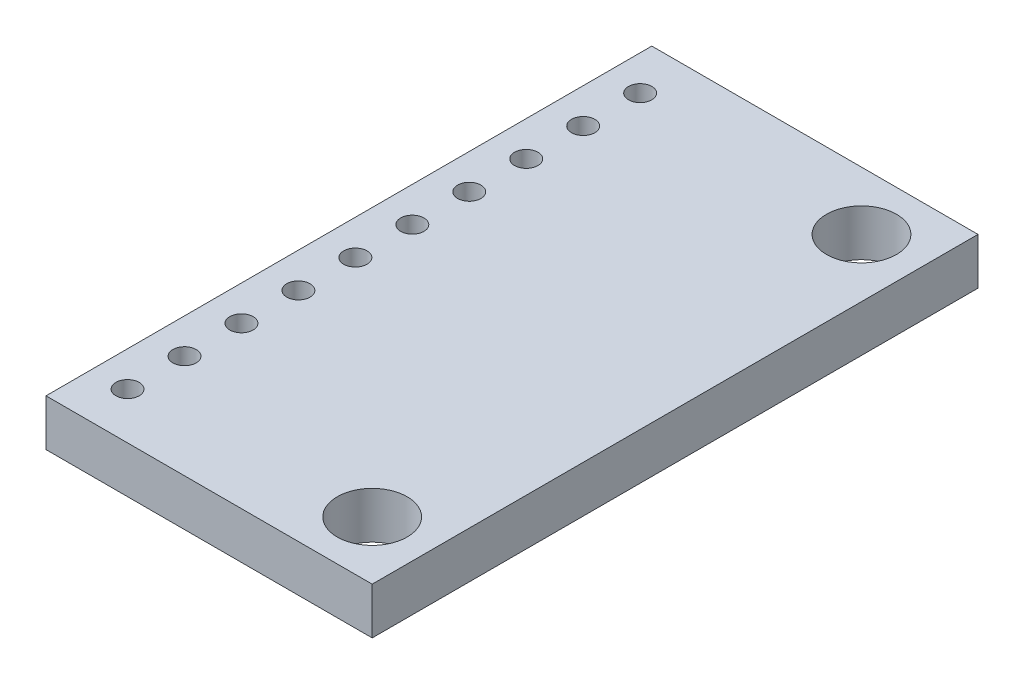
from build123d import *

# Parameters (mm, degrees)
SKETCH1_W           = 14
SKETCH1_H           = 26
BOSS_EXTRUDE1_DEPTH = 2
SKETCH2_R           = 1.5
CUT_EXTRUDE1_DEPTH  = 15.899664426
SKETCH3_R           = 0.5
CUT_EXTRUDE2_DEPTH  = 15.899664426


with BuildPart() as part:
    # Sketch1 → Boss-Extrude1 (new body)
    with BuildSketch(Plane(origin=(0, 0, 0), x_dir=(1, 0, 0), z_dir=(0, 1, 0))):
        Rectangle(SKETCH1_W, SKETCH1_H)
    extrude(amount=BOSS_EXTRUDE1_DEPTH)

    # Sketch2 → Cut-Extrude1 (cut, through all)
    with BuildSketch(Plane(origin=(0, 2, 0), x_dir=(1, 0, 0), z_dir=(0, 1, 0))):
        with Locations((4.5, 10.5)):
            Circle(SKETCH2_R)
        with Locations((4.5, -10.5)):
            Circle(SKETCH2_R)
    extrude(amount=-CUT_EXTRUDE1_DEPTH, mode=Mode.SUBTRACT)

    # Sketch3 → Cut-Extrude2 (cut, through all)
    with BuildSketch(Plane(origin=(0, 2, 0), x_dir=(1, 0, 0), z_dir=(0, 1, 0))):
        with Locations((-5.5, 11)):
            Circle(SKETCH3_R)
        with Locations((-5.5, 8.555556)):
            Circle(SKETCH3_R)
        with Locations((-5.5, 6.111112)):
            Circle(SKETCH3_R)
        with Locations((-5.5, 3.666668)):
            Circle(SKETCH3_R)
        with Locations((-5.5, 1.222224)):
            Circle(SKETCH3_R)
        with Locations((-5.5, -1.22222)):
            Circle(SKETCH3_R)
        with Locations((-5.5, -3.666664)):
            Circle(SKETCH3_R)
        with Locations((-5.5, -6.111108)):
            Circle(SKETCH3_R)
        with Locations((-5.5, -8.555552)):
            Circle(SKETCH3_R)
        with Locations((-5.5, -10.999996)):
            Circle(SKETCH3_R)
    extrude(amount=-CUT_EXTRUDE2_DEPTH, mode=Mode.SUBTRACT)


solid = part.part
